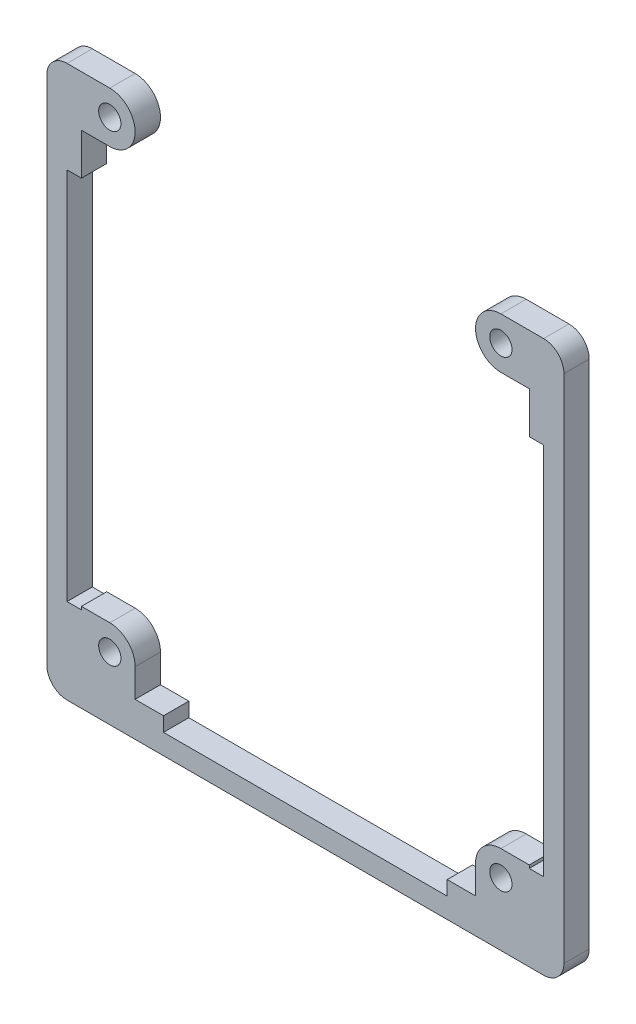
from build123d import *

# Parameters (mm, degrees)
SKETCH1_R           = 3.175
SKETCH1_R_2         = 1.397
BOSS_EXTRUDE1_DEPTH = 3.175


with BuildPart() as part:
    # Sketch1 → Boss-Extrude1 (new body)
    # profile 1 of 5: a face of its own
    with BuildSketch(Plane.XY):
        with BuildLine():
            Line((0, 58.42), (0, 53.213))
            Line((0, 53.213), (1.8034, 53.213))
            Line((1.8034, 53.213), (1.8034, 6.35))
            Line((1.8034, 6.35), (0, 6.35))
            Line((0, 6.35), (0, 6.731))
            Line((0, 6.731), (-3.556, 6.731))
            ThreePointArc((-3.556, 6.731), (-1.31093597, 5.80106403), (-0.381, 3.556))
            ThreePointArc((-0.381, 3.556), (-3.556, 0.381), (-6.731, 3.556))
            Line((-6.731, 3.556), (-6.731, 0))
            Line((-6.731, 0), (-10.287, 0))
            Line((-10.287, 0), (-10.287, -1.8034))
            Line((-10.287, -1.8034), (-45.847, -1.8034))
            Line((-45.847, -1.8034), (-45.847, 0))
            Line((-45.847, 0), (-49.403, 0))
            Line((-49.403, 0), (-49.403, 3.556))
            ThreePointArc((-49.403, 3.556), (-54.82306403, 1.31093597), (-52.578, 6.731))
            Line((-52.578, 6.731), (-56.134, 6.731))
            Line((-56.134, 6.731), (-56.134, 6.35))
            Line((-56.134, 6.35), (-57.9374, 6.35))
            Line((-57.9374, 6.35), (-57.9374, 53.213))
            Line((-57.9374, 53.213), (-56.134, 53.213))
            Line((-56.134, 53.213), (-56.134, 58.42))
            Line((-56.134, 58.42), (-52.578, 58.42))
            ThreePointArc((-52.578, 58.42), (-55.753, 61.595), (-52.578, 64.77))
            Line((-52.578, 64.77), (-57.9374, 64.77))
            ThreePointArc((-57.9374, 64.77), (-59.733451224, 64.026051224), (-60.4774, 62.23))
            Line((-60.4774, 62.23), (-60.4774, -1.8034))
            ThreePointArc((-60.4774, -1.8034), (-59.733451224, -3.599451224), (-57.9374, -4.3434))
            Line((-57.9374, -4.3434), (1.8034, -4.3434))
            ThreePointArc((1.8034, -4.3434), (3.599451224, -3.599451224), (4.3434, -1.8034))
            Line((4.3434, -1.8034), (4.3434, 62.23))
            ThreePointArc((4.3434, 62.23), (3.599451224, 64.026051224), (1.8034, 64.77))
            Line((1.8034, 64.77), (-3.556000021, 64.77))
            ThreePointArc((-3.556000021, 64.77), (-1.310935977, 63.840064038), (-0.381, 61.595))
            ThreePointArc((-0.381, 61.595), (-1.31093597, 59.34993597), (-3.556, 58.42))
            Line((-3.556, 58.42), (0, 58.42))
        make_face()
    # profile 2 of 5: a face of its own
    with BuildSketch(Plane.XY):
        with Locations((-52.578, 61.595)):
            Circle(SKETCH1_R)
        with Locations((-52.578, 61.595)):
            Circle(SKETCH1_R_2, mode=Mode.SUBTRACT)
    # profile 3 of 5: a face of its own
    with BuildSketch(Plane.XY):
        with Locations((-3.556, 61.595)):
            Circle(SKETCH1_R)
        with Locations((-3.556, 61.595)):
            Circle(SKETCH1_R_2, mode=Mode.SUBTRACT)
    # profile 4 of 5: a face of its own
    with BuildSketch(Plane.XY):
        with Locations((-52.578, 3.556)):
            Circle(SKETCH1_R)
        with Locations((-52.578, 3.556)):
            Circle(SKETCH1_R_2, mode=Mode.SUBTRACT)
    # profile 5 of 5: a face of its own
    with BuildSketch(Plane.XY):
        with Locations((-3.556, 3.556)):
            Circle(SKETCH1_R)
        with Locations((-3.556, 3.556)):
            Circle(SKETCH1_R_2, mode=Mode.SUBTRACT)
    extrude(amount=BOSS_EXTRUDE1_DEPTH)


solid = part.part
